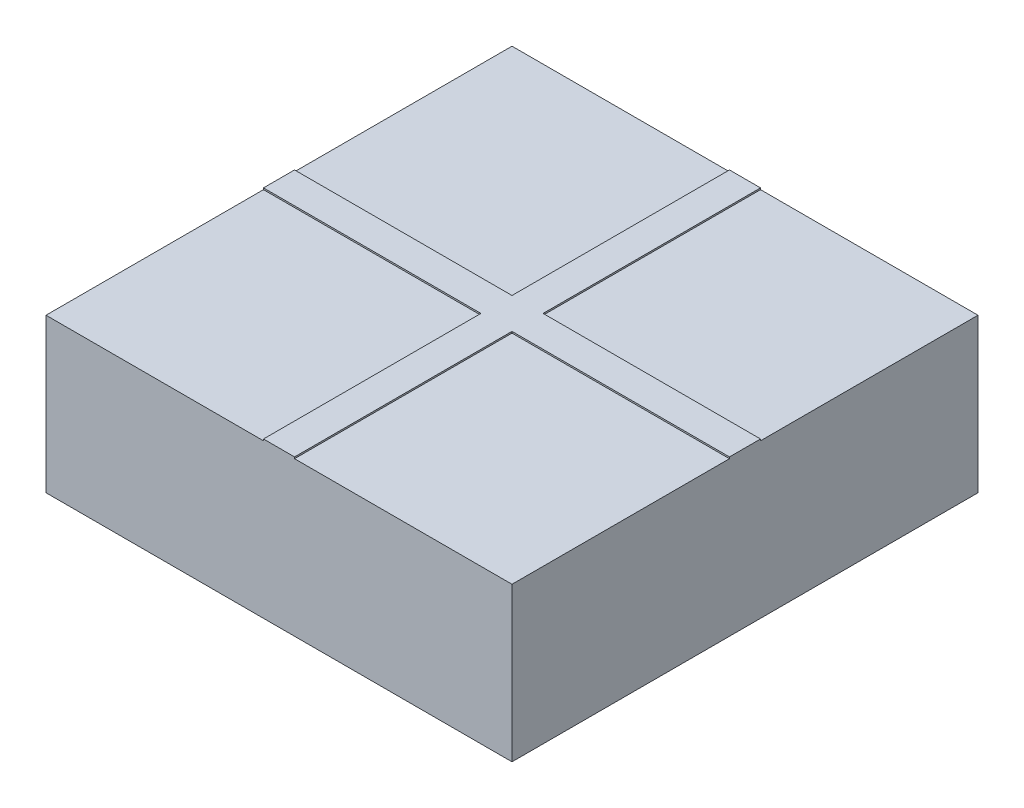
from build123d import *

# Parameters (mm, degrees)
SKETCH_1_W      = 300
SKETCH_1_H      = 300
EXTRUDE_1_DEPTH = 90
SKETCH_2_W      = 20
SKETCH_2_H      = 300
SKETCH_2_W_2    = 300
SKETCH_2_H_2    = 20
EXTRUDE_3_DEPTH = 10
SKETCH_6_W      = 140
SKETCH_6_H      = 140
EXTRUDE_6_DEPTH = 9


with BuildPart() as part:
    # Эскиз1 → Бобышка-Вытянуть1 (new body)
    with BuildSketch(Plane(origin=(0, 0, 0), x_dir=(1, 0, 0), z_dir=(0, 1, 0))):
        Rectangle(SKETCH_1_W, SKETCH_1_H)
    extrude(amount=EXTRUDE_1_DEPTH)

    # Эскиз2 → Бобышка-Вытянуть3 (add)
    with BuildSketch(Plane(origin=(0, 90, 0), x_dir=(1, 0, 0), z_dir=(0, 1, 0))):
        Rectangle(SKETCH_2_W, SKETCH_2_H)
        Rectangle(SKETCH_2_W_2, SKETCH_2_H_2)
    extrude(amount=EXTRUDE_3_DEPTH)

    # Эскиз6 → Бобышка-Вытянуть6 (add)
    with BuildSketch(Plane(origin=(0, 90, 0), x_dir=(1, 0, 0), z_dir=(0, 1, 0))):
        with Locations((-80, -80)):
            Rectangle(SKETCH_6_W, SKETCH_6_H)
        with Locations((80, -80)):
            Rectangle(SKETCH_6_W, SKETCH_6_H)
        with Locations((80, 80)):
            Rectangle(SKETCH_6_W, SKETCH_6_H)
        with Locations((-80, 80)):
            Rectangle(SKETCH_6_W, SKETCH_6_H)
    extrude(amount=EXTRUDE_6_DEPTH)


solid = part.part
